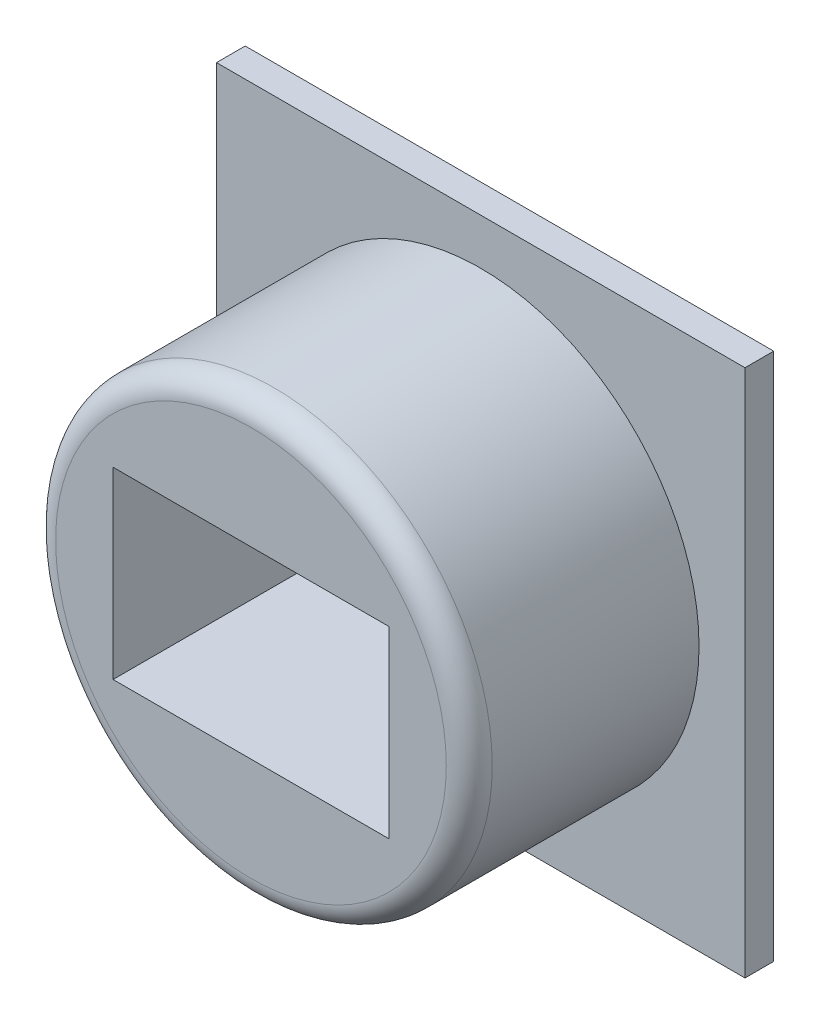
from build123d import *

# Parameters (mm, degrees)
SKETCH_1_R          = 3.8
EXTRUDE_1_DEPTH     = 4
SKETCH_2_W          = 9.2
SKETCH_2_H          = 9.2
EXTRUDE_2_DEPTH     = 0.5
FILLET_1_R          = 0.4
SKETCH_4_W          = 4.8
SKETCH_4_H          = 3.2
CUT_EXTRUDE_1_DEPTH = 4
SKETCH_5_R          = 0.6
CUT_EXTRUDE_2_DEPTH = 8.636753237


with BuildPart() as part:
    # Эскиз1 → Бобышка-Вытянуть1 (new body)
    with BuildSketch(Plane.XY):
        Circle(SKETCH_1_R)
    extrude(amount=EXTRUDE_1_DEPTH)

    # Эскиз2 → Бобышка-Вытянуть2 (add)
    with BuildSketch(Plane(origin=(0, 0, 0), x_dir=(-1, 0, 0), z_dir=(0, 0, -1))):
        Rectangle(SKETCH_2_W, SKETCH_2_H)
    extrude(amount=EXTRUDE_2_DEPTH)

    # Скругление1
    fillet_1_edges = [part.edges().sort_by_distance(p)[0] for p in [
        (-3.8, 0, 4),
    ]]
    fillet(fillet_1_edges, radius=FILLET_1_R)

    # Эскиз4 → Вырез-Вытянуть1 (cut)
    with BuildSketch(Plane.XY.offset(4)):
        Rectangle(SKETCH_4_W, SKETCH_4_H)
    extrude(amount=-CUT_EXTRUDE_1_DEPTH, mode=Mode.SUBTRACT)

    # Эскиз5 → Вырез-Вытянуть2 (cut, through all)
    with BuildSketch(Plane.XY):
        Circle(SKETCH_5_R)
    extrude(amount=-CUT_EXTRUDE_2_DEPTH, mode=Mode.SUBTRACT)


solid = part.part
